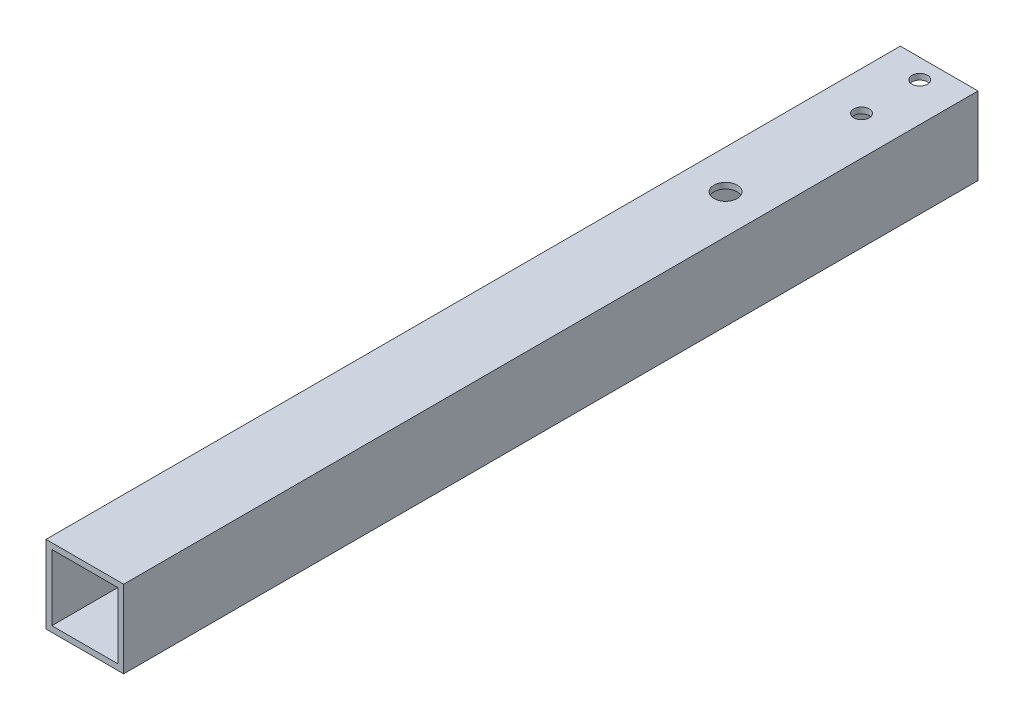
from build123d import *

# Parameters (mm, degrees)
SKETCH_1_W          = 20
SKETCH_1_H          = 20
SKETCH_1_W_2        = 17
SKETCH_1_H_2        = 17
EXTRUDE_1_DEPTH     = 220
SKETCH_3_R          = 2
CUT_EXTRUDE_1_DEPTH = 23
SKETCH_4_R          = 3
CUT_EXTRUDE_2_DEPTH = 222.133443875


with BuildPart() as part:
    # 草图1 → 凸台-拉伸1 (new body)
    with BuildSketch(Plane.XY):
        Rectangle(SKETCH_1_W, SKETCH_1_H)
        Rectangle(SKETCH_1_W_2, SKETCH_1_H_2, mode=Mode.SUBTRACT)
    extrude(amount=EXTRUDE_1_DEPTH)

    # 草图3 → 切除-拉伸1 (cut)
    with BuildSketch(Plane.XZ.offset(10)):
        with Locations(Location((0, 20, 0), (0, 0, 270))):
            Circle(SKETCH_3_R)
        with Locations(Location((0, 5, 0), (0, 0, 270))):
            Circle(SKETCH_3_R)
    extrude(amount=-CUT_EXTRUDE_1_DEPTH, mode=Mode.SUBTRACT)

    # 草图4 → 切除-拉伸2 (cut, through all)
    with BuildSketch(Plane(origin=(0, 10, 0), x_dir=(1, 0, 0), z_dir=(0, 1, 0))):
        with Locations(Location((0, -55, 0), (0, 0, 270))):
            Circle(SKETCH_4_R)
    extrude(amount=-CUT_EXTRUDE_2_DEPTH, mode=Mode.SUBTRACT)


solid = part.part
